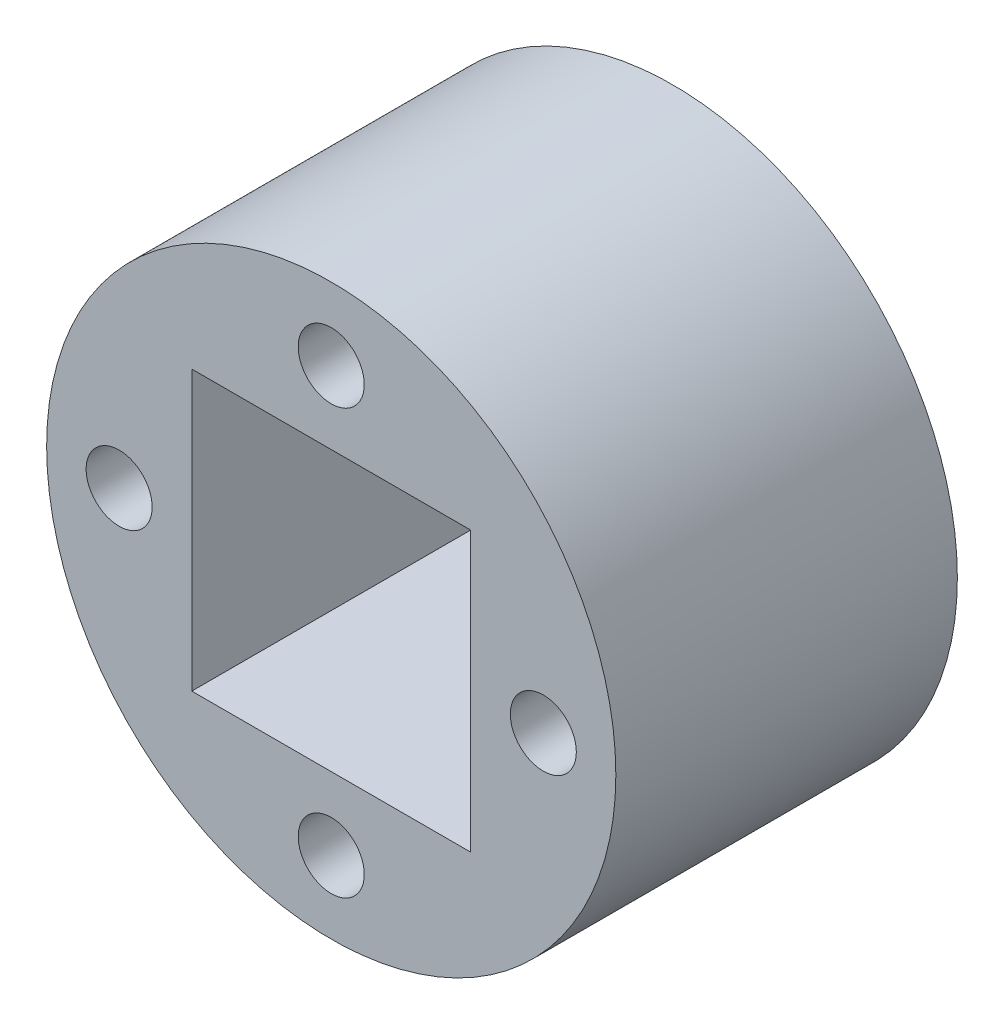
from build123d import *

# Parameters (mm, degrees)
SKETCH1_R           = 12.5
BOSS_EXTRUDE1_DEPTH = 7.5
CUT_EXTRUDE1_REACH  = 25.184
SKETCH8_W           = 12.25
SKETCH8_H           = 12.25
CUT_EXTRUDE4_REACH  = 25.184
SKETCH11_R          = 1.45


with BuildPart() as part:
    # Sketch1 → Boss-Extrude1 (new, symmetric)
    with BuildSketch(Plane.XY):
        Circle(SKETCH1_R)
    extrude(amount=BOSS_EXTRUDE1_DEPTH, both=True)

    # Sketch8 → Cut-Extrude1 (cut, up to next)
    with BuildSketch(Plane.XY.offset(7.5), mode=Mode.PRIVATE) as cut_extrude1_sk1:
        Rectangle(SKETCH8_W, SKETCH8_H)
    cut_extrude1_tool1 = extrude(cut_extrude1_sk1.sketch, amount=-CUT_EXTRUDE1_REACH, mode=Mode.PRIVATE) & part.part
    add(cut_extrude1_tool1.solids().sort_by_distance((0, 0, 7.5))[0], mode=Mode.SUBTRACT)

    # Sketch11 → Cut-Extrude4 (cut, up to next)
    with BuildSketch(Plane.XY.offset(7.5), mode=Mode.PRIVATE) as cut_extrude4_sk1:
        with Locations((9.315, 0)):
            Circle(SKETCH11_R)
    cut_extrude4_tool1 = extrude(cut_extrude4_sk1.sketch, amount=-CUT_EXTRUDE4_REACH, mode=Mode.PRIVATE) & part.part
    # Sketch11 → Cut-Extrude4 (cut, up to next)
    with BuildSketch(Plane.XY.offset(7.5), mode=Mode.PRIVATE) as cut_extrude4_sk2:
        with Locations((0, -9.315)):
            Circle(SKETCH11_R)
    cut_extrude4_tool2 = extrude(cut_extrude4_sk2.sketch, amount=-CUT_EXTRUDE4_REACH, mode=Mode.PRIVATE) & part.part
    # Sketch11 → Cut-Extrude4 (cut, up to next)
    with BuildSketch(Plane.XY.offset(7.5), mode=Mode.PRIVATE) as cut_extrude4_sk3:
        with Locations((-9.315, 0)):
            Circle(SKETCH11_R)
    cut_extrude4_tool3 = extrude(cut_extrude4_sk3.sketch, amount=-CUT_EXTRUDE4_REACH, mode=Mode.PRIVATE) & part.part
    # Sketch11 → Cut-Extrude4 (cut, up to next)
    with BuildSketch(Plane.XY.offset(7.5), mode=Mode.PRIVATE) as cut_extrude4_sk4:
        with Locations((0, 9.315)):
            Circle(SKETCH11_R)
    cut_extrude4_tool4 = extrude(cut_extrude4_sk4.sketch, amount=-CUT_EXTRUDE4_REACH, mode=Mode.PRIVATE) & part.part
    add(cut_extrude4_tool1.solids().sort_by_distance((9.315, 0, 7.5))[0], mode=Mode.SUBTRACT)
    add(cut_extrude4_tool2.solids().sort_by_distance((0, -9.315, 7.5))[0], mode=Mode.SUBTRACT)
    add(cut_extrude4_tool3.solids().sort_by_distance((-9.315, 0, 7.5))[0], mode=Mode.SUBTRACT)
    add(cut_extrude4_tool4.solids().sort_by_distance((0, 9.315, 7.5))[0], mode=Mode.SUBTRACT)


solid = part.part
